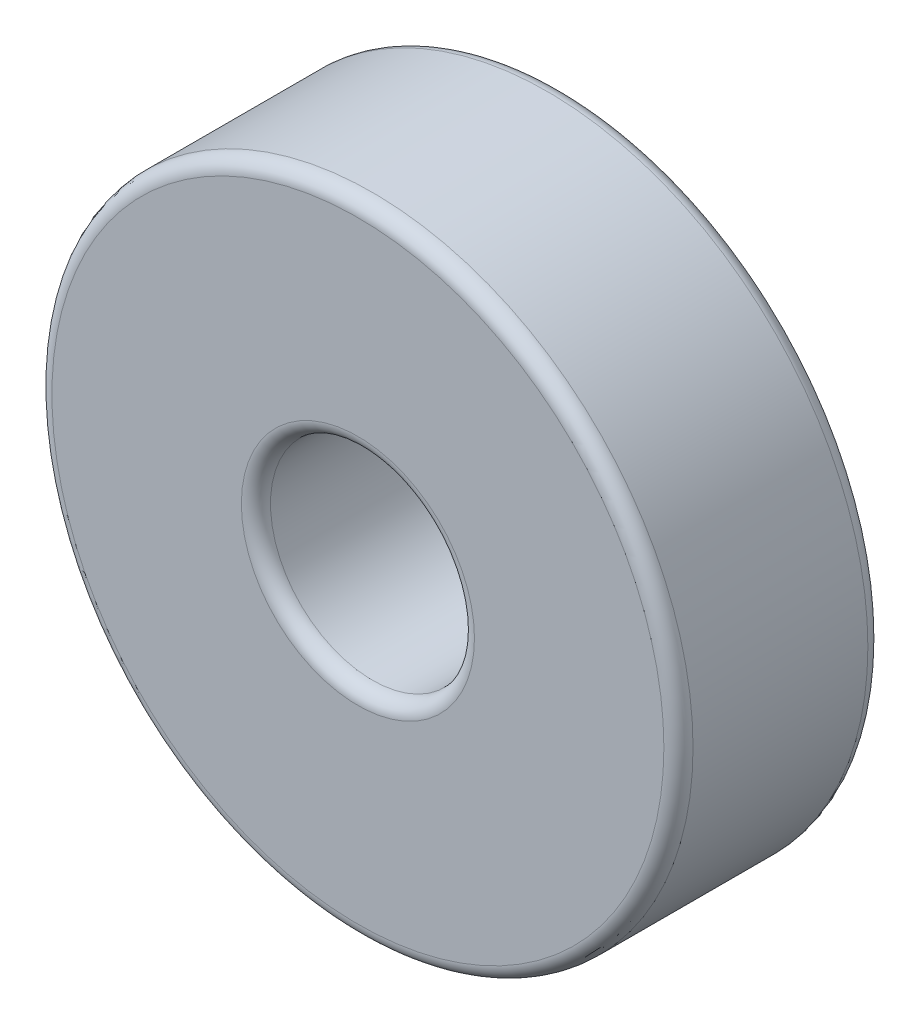
from build123d import *

# Parameters (mm, degrees)
SKETCH_1_R      = 11
SKETCH_1_R_2    = 3.5
EXTRUDE_1_DEPTH = 7
FILLET_1_R      = 0.5


with BuildPart() as part:
    # Эскиз1 → Бобышка-Вытянуть1 (new body)
    with BuildSketch(Plane.XY):
        Circle(SKETCH_1_R)
        Circle(SKETCH_1_R_2, mode=Mode.SUBTRACT)
    extrude(amount=EXTRUDE_1_DEPTH)

    # Скругление1
    fillet_1_edges = [part.edges().sort_by_distance(p)[0] for p in [
        (-11, 0, 0),
        (-11, 0, 7),
        (-3.5, 0, 0),
        (-3.5, 0, 7),
    ]]
    fillet(fillet_1_edges, radius=FILLET_1_R)


solid = part.part
